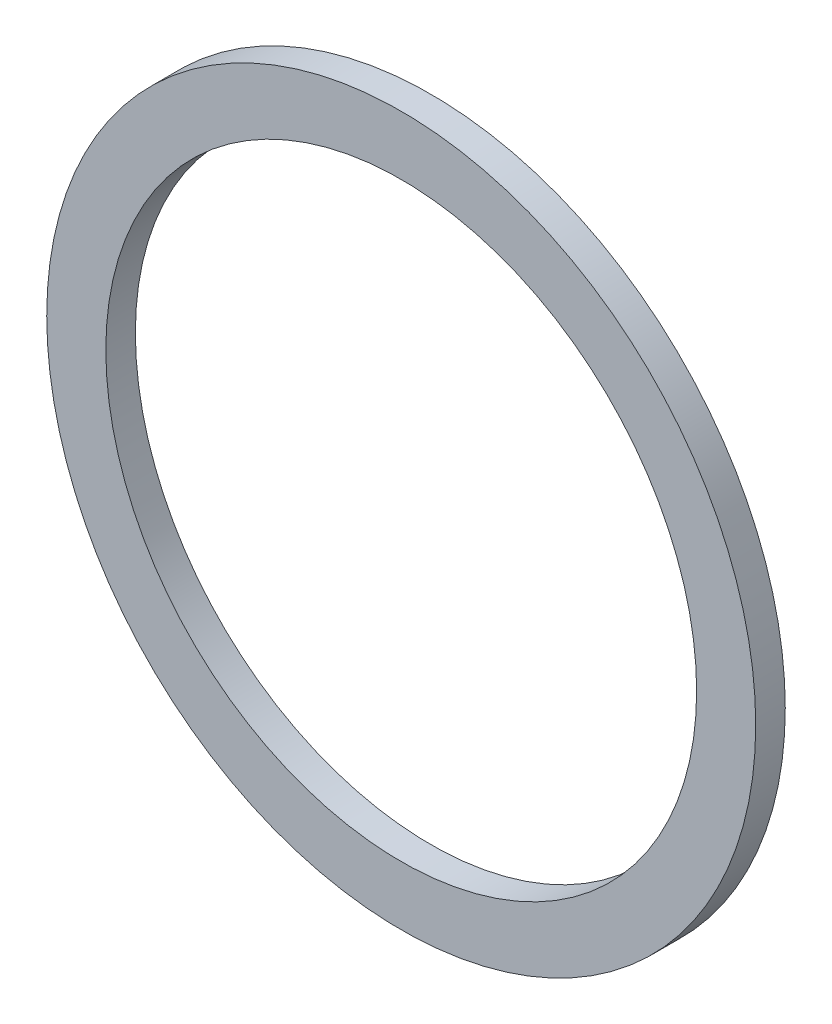
from build123d import *

# Parameters (mm, degrees)
SKETCH1_R           = 12
SKETCH1_R_2         = 10
BOSS_EXTRUDE1_DEPTH = 1


with BuildPart() as part:
    # Sketch1 → Boss-Extrude1 (new body)
    with BuildSketch(Plane.XY):
        Circle(SKETCH1_R)
        Circle(SKETCH1_R_2, mode=Mode.SUBTRACT)
    extrude(amount=BOSS_EXTRUDE1_DEPTH)


solid = part.part
